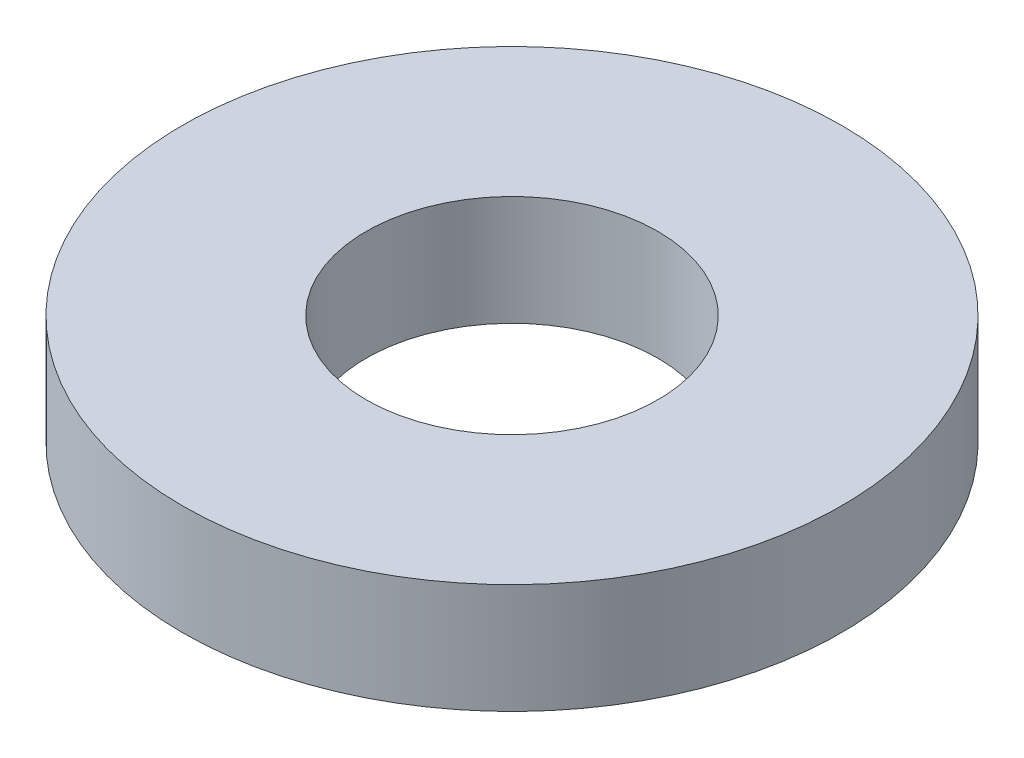
from build123d import *

# Parameters (mm, degrees)
SKETCH1_R           = 4.7625
SKETCH1_R_2         = 2.1082
BOSS_EXTRUDE1_DEPTH = 1.5875


with BuildPart() as part:
    # Sketch1 → Boss-Extrude1 (new body)
    with BuildSketch(Plane(origin=(0, 0, 0), x_dir=(1, 0, 0), z_dir=(0, 1, 0))):
        with Locations(Location((0, 0, 0), (0, 0, 270))):
            Circle(SKETCH1_R)
        with Locations(Location((0, 0, 0), (0, 0, 270))):
            Circle(SKETCH1_R_2, mode=Mode.SUBTRACT)
    extrude(amount=BOSS_EXTRUDE1_DEPTH)


solid = part.part
